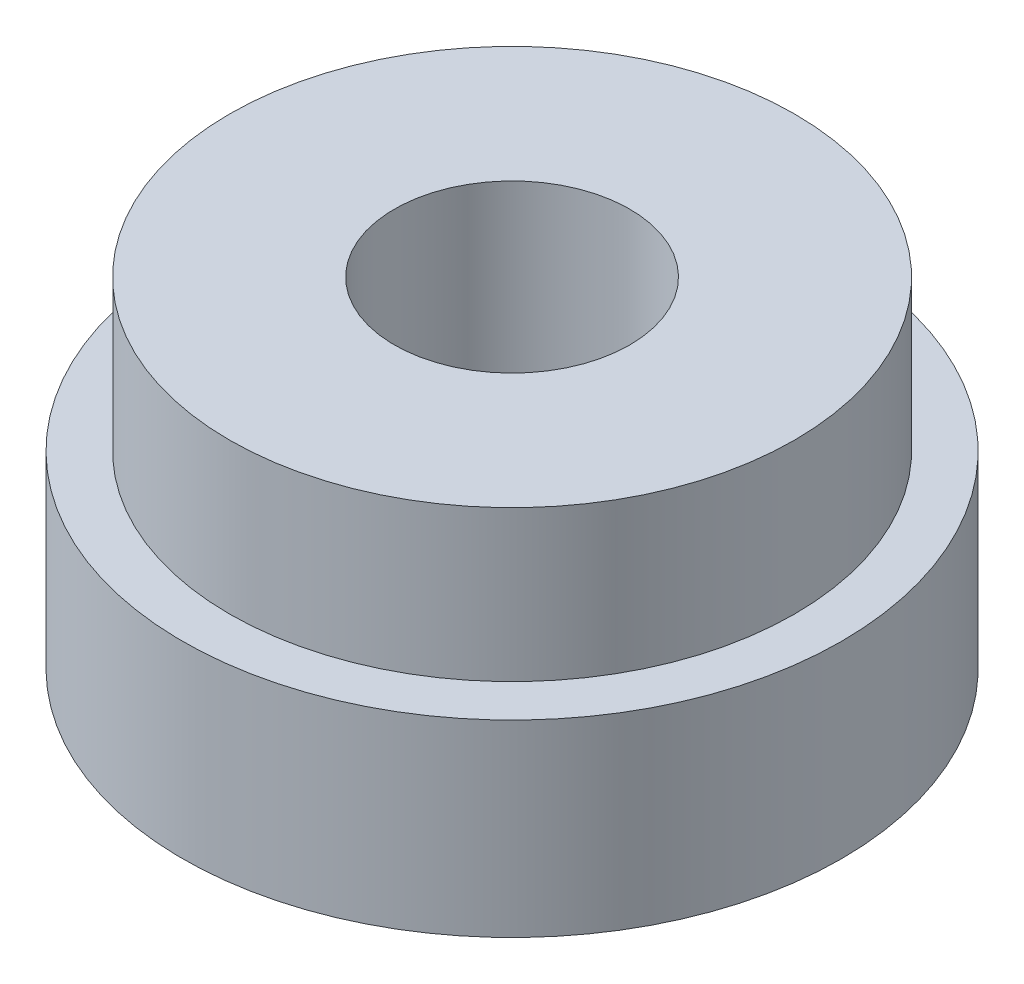
from build123d import *


with BuildPart() as part:
    # ｽｹｯﾁ1 → 回転1 (revolve)
    with BuildSketch(Plane.XY):
        Polygon((1.25, 0), (1.25, 3.6), (3, 3.6), (3, 2), (3.5, 2), (3.5, 0), align=None)
    revolve(axis=Axis((0, 0, 0), (0, 1, 0)))


solid = part.part
